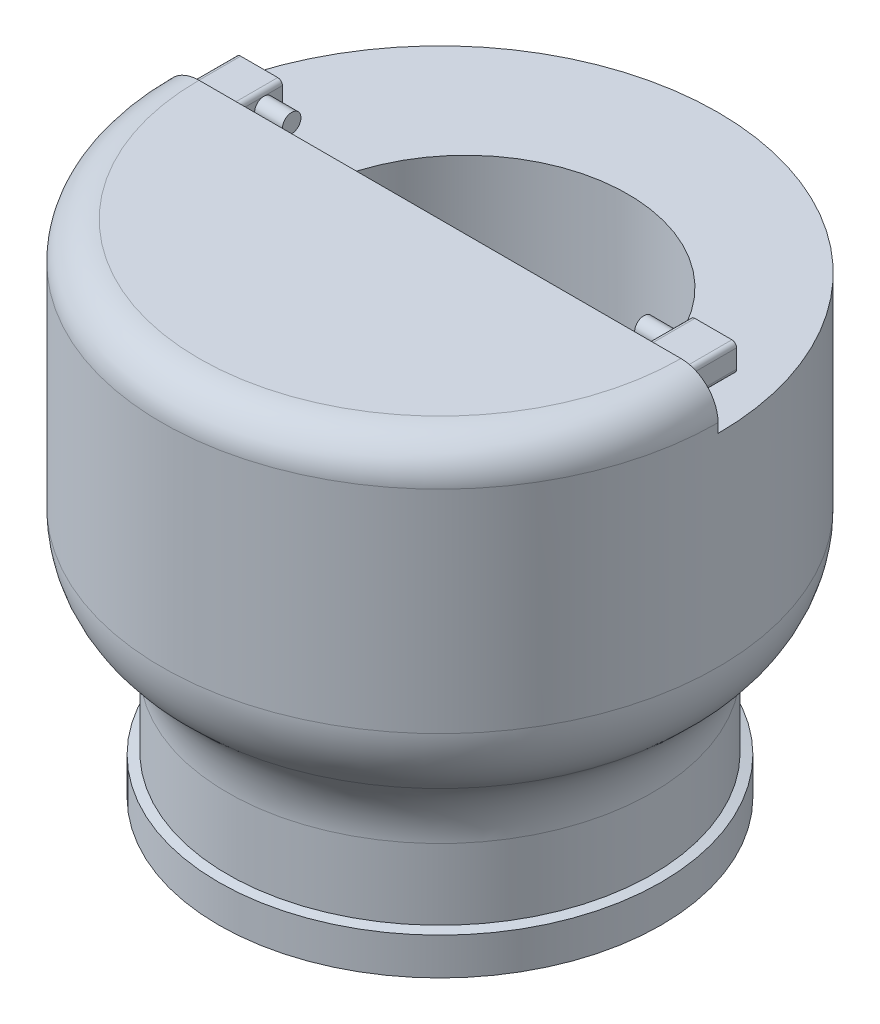
from build123d import *

# Parameters (mm, degrees)
SKETCH10_R              = 10
BOSS_EXTRUDE1_DEPTH     = 5
CUT_EXTRUDE3_DEPTH      = 45
CUT_EXTRUDE3_DEPTH_BACK = 20
CUT_EXTRUDE5_DEPTH      = 5
BOSS_EXTRUDE2_DEPTH     = 5
SKETCH14_R              = 1
BOSS_EXTRUDE3_DEPTH     = 3
BOSS_EXTRUDE4_START     = 3
SKETCH15_R              = 1
BOSS_EXTRUDE4_DEPTH     = 3


with BuildPart() as part:
    # Sketch1 → Revolve1 (revolve)
    with BuildSketch(Plane.XY):
        with BuildLine():
            Line((20.9, 0), (23.871591838, 0))
            Line((23.871591838, 0), (23.871591838, 4))
            Line((23.871591838, 4), (22.9, 4.236662843))
            Line((22.9, 4.236662843), (22.9, 11.874576818))
            ThreePointArc((22.9, 11.874576818), (23.83692213, 16.100759435), (26.472123903, 19.535021249))
            Line((26.472123903, 19.535021249), (26.427876097, 19.497892931))
            ThreePointArc((26.427876097, 19.497892931), (29.06307787, 22.932154745), (30, 27.158337362))
            Line((30, 27.158337362), (30, 50))
            ThreePointArc((30, 50), (28.828427125, 52.828427125), (26, 54))
            Line((26, 54), (0, 54))
            Line((0, 54), (0, 15))
            Line((0, 15), (19.9, 15))
            ThreePointArc((19.9, 15), (20.607106781, 14.707106781), (20.9, 14))
            Line((20.9, 14), (20.9, 0))
        make_face()
    revolve(axis=Axis((0, 0, 0), (0, 1, 0)))

    # Sketch10 → Boss-Extrude1 (add)
    with BuildSketch(Plane(origin=(0, 0, -30), x_dir=(-1, 0, 0), z_dir=(0, 0, -1))):
        with Locations((3.346345887, 38.658337362)):
            Circle(SKETCH10_R)
    extrude(amount=-BOSS_EXTRUDE1_DEPTH)

    # Sketch11 → Cut-Extrude3 (cut, two sides: drawn at the far end of the back side and taken through both)
    with BuildSketch(Plane(origin=(0, 17, 0), x_dir=(1, 0, 0), z_dir=(0, 1, 0)).offset(-CUT_EXTRUDE3_DEPTH_BACK)):
        with BuildLine():
            Line((-14.735085045, 0), (20.264914955, 0))
            ThreePointArc((20.264914955, 0), (2.764914955, 17.5), (-14.735085045, 0))
        make_face()
    extrude(amount=CUT_EXTRUDE3_DEPTH + CUT_EXTRUDE3_DEPTH_BACK, mode=Mode.SUBTRACT)

    # Sketch9 → Cut-Extrude5 (cut)
    with BuildSketch(Plane(origin=(0, 54, 0), x_dir=(1, 0, 0), z_dir=(0, 1, 0))):
        with BuildLine():
            Line((-30, 0), (30, 0))
            ThreePointArc((30, 0), (0, 30), (-30, 0))
        make_face()
    extrude(amount=-CUT_EXTRUDE5_DEPTH, mode=Mode.SUBTRACT)

    # Sketch13 → Boss-Extrude2 (add)
    with BuildSketch(Plane(origin=(0, 0, 0), x_dir=(-1, 0, 0), z_dir=(0, 0, -1))):
        with BuildLine():
            Line((22.5, 53.5), (26.5, 53.5))
            ThreePointArc((26.5, 53.5), (26.853553391, 53.353553391), (27, 53))
            Line((27, 53), (27, 51))
            ThreePointArc((27, 51), (26.853553391, 50.646446609), (26.5, 50.5))
            Line((26.5, 50.5), (22.5, 50.5))
            ThreePointArc((22.5, 50.5), (22.146446609, 50.646446609), (22, 51))
            Line((22, 51), (22, 53))
            ThreePointArc((22, 53), (22.146446609, 53.353553391), (22.5, 53.5))
        make_face()
        with BuildLine():
            Line((-26.5, 53.5), (-22.5, 53.5))
            ThreePointArc((-22.5, 53.5), (-22.146446609, 53.353553391), (-22, 53))
            Line((-22, 53), (-22, 51))
            ThreePointArc((-22, 51), (-22.146446609, 50.646446609), (-22.5, 50.5))
            Line((-22.5, 50.5), (-26.5, 50.5))
            ThreePointArc((-26.5, 50.5), (-26.853553391, 50.646446609), (-27, 51))
            Line((-27, 51), (-27, 53))
            ThreePointArc((-27, 53), (-26.853553391, 53.353553391), (-26.5, 53.5))
        make_face()
    extrude(amount=BOSS_EXTRUDE2_DEPTH)

    # Sketch14 → Boss-Extrude3 (add)
    with BuildSketch(Plane.ZY.offset(-22)):
        with Locations((-3, 52)):
            Circle(SKETCH14_R)
    extrude(amount=BOSS_EXTRUDE3_DEPTH)

    # Sketch15 → Boss-Extrude4 (add)
    with BuildSketch(Plane(origin=(-22, 0, 0), x_dir=(0, 0, -1), z_dir=(1, 0, 0)).offset(BOSS_EXTRUDE4_START)):
        with Locations((3, 52)):
            Circle(SKETCH15_R)
    extrude(amount=-BOSS_EXTRUDE4_DEPTH)


solid = part.part
